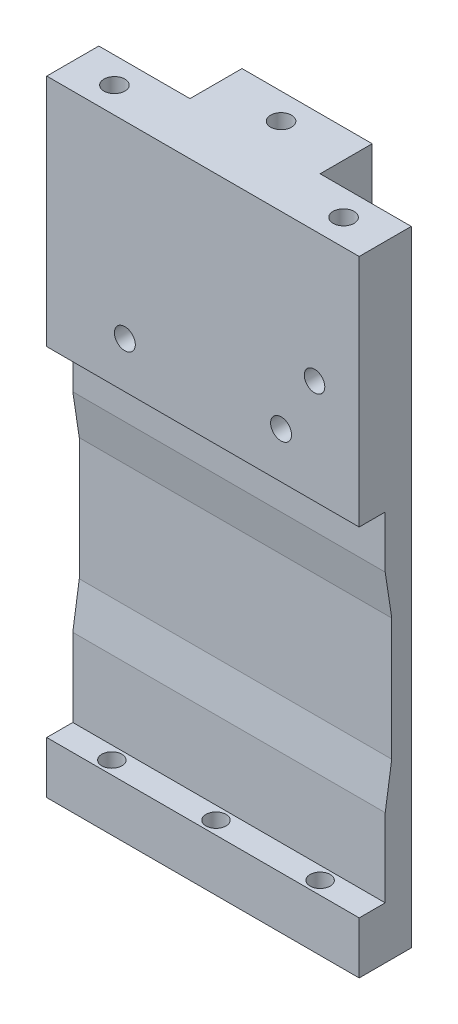
from build123d import *

# Parameters (mm, degrees)
BOSS_EXTRUDE1_DEPTH              = 76.2
CUT_EXTRUDE3_DEPTH               = 47.625
CUT_EXTRUDE4_DEPTH               = 110.433918417
F_10_0_1935_DIAMETER_HOLE1_D     = 4.9149
F_10_0_1935_DIAMETER_HOLE1_DEPTH = 19.05
F_10_0_1935_DIAMETER_HOLE1_TIP   = 1.476584928
F_1_4_20_TAPPED_HOLE1_D          = 5.1054
SKETCH19_R                       = 2.499999953
CUT_EXTRUDE5_DEPTH               = 87.135590889
F_1_4_20_TAPPED_HOLE2_D          = 5.1054
F_1_4_20_TAPPED_HOLE2_DEPTH      = 20.691183098
F_1_4_20_TAPPED_HOLE2_TIP        = 1.533816902
F_1_4_20_TAPPED_HOLE3_D          = 5.1054
F_1_4_20_TAPPED_HOLE3_DEPTH      = 9.05002
F_1_4_20_TAPPED_HOLE3_TIP        = 1.533816902
F_1_4_20_TAPPED_HOLE4_D          = 5.1054
F_1_4_20_TAPPED_HOLE4_DEPTH      = 7.356183098
F_1_4_20_TAPPED_HOLE4_TIP        = 1.533816902


with BuildPart() as part:
    # Sketch1 → Boss-Extrude1 (new, symmetric)
    with BuildSketch(Plane(origin=(0, 0, 0), x_dir=(1, 0, 0), z_dir=(0, 1, 0))):
        Polygon((-15.875, 6.35), (-15.875, 19.05), (15.875, 19.05), (15.875, 6.35), (38.1, 6.35), (38.1, -6.35), (-38.1, -6.35), (-38.1, 6.35), align=None)
    extrude(amount=BOSS_EXTRUDE1_DEPTH, both=True)

    # Sketch5 → Cut-Extrude3 (cut, symmetric)
    with BuildSketch(Plane(origin=(0, 0, 0), x_dir=(1, 0, 0), z_dir=(0, 1, 0))):
        with BuildLine():
            Line((-4.7625, 19.05), (-4.7625, 12.7))
            ThreePointArc((-4.7625, 12.7), (0, 7.9375), (4.7625, 12.7))
            Line((4.7625, 12.7), (4.7625, 19.05))
            Line((4.7625, 19.05), (-4.7625, 19.05))
        make_face()
    extrude(amount=CUT_EXTRUDE3_DEPTH, both=True, mode=Mode.SUBTRACT)

    # Sketch9 → Cut-Revolve1 (revolve, cut)
    with BuildSketch(Plane(origin=(0, 0, 0), x_dir=(0, 0, -1), z_dir=(1, 0, 0))):
        with BuildLine():
            Line((19.05, -52.3875), (12.7, -52.3875))
            ThreePointArc((12.7, -52.3875), (9.332403955, -50.992596045), (7.9375, -47.625))
            Line((7.9375, -47.625), (19.05, -47.625))
            Line((19.05, -47.625), (19.05, -52.3875))
        make_face()
    cut_revolve1 = revolve(axis=Axis((0, -47.625, -7.9375), (0, 0, -1)), mode=Mode.SUBTRACT)

    # Mirror1: Cut-Revolve1 across plane
    add(cut_revolve1.mirror(Plane.ZX), mode=Mode.SUBTRACT)

    # Sketch12 → Cut-Extrude4 (cut, through all)
    with BuildSketch(Plane(origin=(38.1, 0, 0), x_dir=(0, 0, -1), z_dir=(1, 0, 0))):
        Polygon((-6.35, -63.5), (0, -63.5), (0, -44.45), (1.5875, -33.956087115), (1.5875, -4.143912885), (0, 6.35), (0, 19.05), (-6.35, 19.05), align=None)
    extrude(amount=-CUT_EXTRUDE4_DEPTH, mode=Mode.SUBTRACT)

    # #10 (0.1935) Diameter Hole1
    with Locations(Plane(origin=(0, -76.2, 0), x_dir=(-1, 0, 0), z_dir=(0, -1, 0))):
        with Locations((25.4, -3.175), (-25.4, -3.175), (0, -3.175)):
            Hole(F_10_0_1935_DIAMETER_HOLE1_D / 2, depth=F_10_0_1935_DIAMETER_HOLE1_DEPTH)
            with Locations((0, 0, -(F_10_0_1935_DIAMETER_HOLE1_DEPTH + F_10_0_1935_DIAMETER_HOLE1_TIP / 2))):  # 118° drill point
                Cone(0, F_10_0_1935_DIAMETER_HOLE1_D / 2, F_10_0_1935_DIAMETER_HOLE1_TIP, mode=Mode.SUBTRACT)

    # 1/4-20 Tapped Hole1 (through all)
    with Locations(Plane(origin=(0, 76.2, 0), x_dir=(1, 0, 0), z_dir=(0, 1, 0))):
        with Locations((0, 12.7)):
            Hole(F_1_4_20_TAPPED_HOLE1_D / 2)

    # Sketch19 → Cut-Extrude5 (cut, through all)
    with BuildSketch(Plane(origin=(0, 0, -6.35), x_dir=(-1, 0, 0), z_dir=(0, 0, -1))):
        with Locations((-27.209019229, 44.45)):
            Circle(SKETCH19_R)
    extrude(amount=-CUT_EXTRUDE5_DEPTH, mode=Mode.SUBTRACT)

    # 1/4-20 Tapped Hole2
    with Locations(Plane(origin=(0, 76.2, 0), x_dir=(1, 0, 0), z_dir=(0, 1, 0))):
        with Locations((27.94, 0), (-27.94, 0)):
            Hole(F_1_4_20_TAPPED_HOLE2_D / 2, depth=F_1_4_20_TAPPED_HOLE2_DEPTH)
            with Locations((0, 0, -(F_1_4_20_TAPPED_HOLE2_DEPTH + F_1_4_20_TAPPED_HOLE2_TIP / 2))):  # 118° drill point
                Cone(0, F_1_4_20_TAPPED_HOLE2_D / 2, F_1_4_20_TAPPED_HOLE2_TIP, mode=Mode.SUBTRACT)

    # 1/4-20 Tapped Hole3
    with Locations(Plane(origin=(0, 0, -19.05), x_dir=(-1, 0, 0), z_dir=(0, 0, -1))):
        with Locations((-9.525, -66.675), (9.525, 57.15), (-9.525, 57.15), (9.525, -66.675)):
            Hole(F_1_4_20_TAPPED_HOLE3_D / 2, depth=F_1_4_20_TAPPED_HOLE3_DEPTH)
            with Locations((0, 0, -(F_1_4_20_TAPPED_HOLE3_DEPTH + F_1_4_20_TAPPED_HOLE3_TIP / 2))):  # 118° drill point
                Cone(0, F_1_4_20_TAPPED_HOLE3_D / 2, F_1_4_20_TAPPED_HOLE3_TIP, mode=Mode.SUBTRACT)

    # 1/4-20 Tapped Hole4
    with Locations(Plane.XY.offset(6.35)):
        with Locations((19.05, 30.260695081), (-19.05, 30.260695081)):
            Hole(F_1_4_20_TAPPED_HOLE4_D / 2, depth=F_1_4_20_TAPPED_HOLE4_DEPTH)
            with Locations((0, 0, -(F_1_4_20_TAPPED_HOLE4_DEPTH + F_1_4_20_TAPPED_HOLE4_TIP / 2))):  # 118° drill point
                Cone(0, F_1_4_20_TAPPED_HOLE4_D / 2, F_1_4_20_TAPPED_HOLE4_TIP, mode=Mode.SUBTRACT)


solid = part.part
